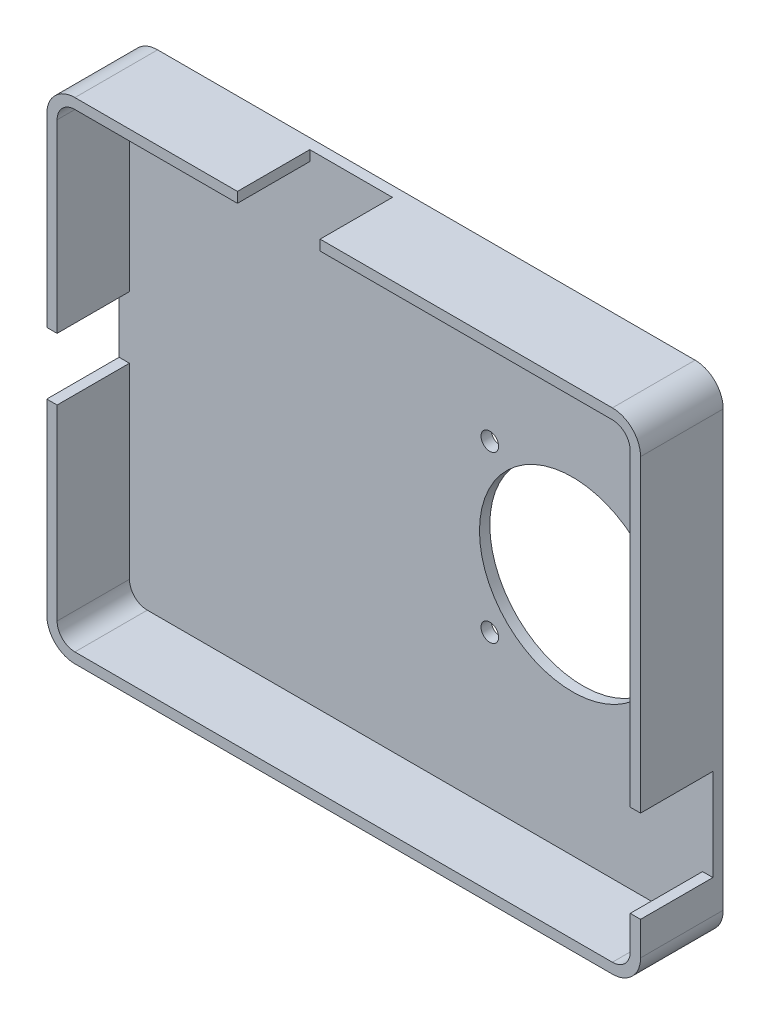
from build123d import *

# Parameters (mm, degrees)
BOSS_EXTRUDE1_DEPTH = 14
BOSS_EXTRUDE2_START = 2
BOSS_EXTRUDE2_DEPTH = 2
SKETCH4_W           = 2
SKETCH4_H           = 12
CUT_EXTRUDE1_DEPTH  = 94
SKETCH5_R           = 1.7
SKETCH5_R_2         = 18
CUT_EXTRUDE2_DEPTH  = 10
CUT_EXTRUDE3_DEPTH  = 1


with BuildPart() as part:
    # Sketch1 → Boss-Extrude1 (new body)
    with BuildSketch(Plane.XY):
        with BuildLine():
            Line((52, 47.45), (-52, 47.45))
            ThreePointArc((-52, 47.45), (-55.853731957, 45.853731957), (-57.45, 42))
            Line((-57.45, 42), (-57.45, -42))
            ThreePointArc((-57.45, -42), (-55.853731957, -45.853731957), (-52, -47.45))
            Line((-52, -47.45), (52, -47.45))
            ThreePointArc((52, -47.45), (55.853731957, -45.853731957), (57.45, -42))
            Line((57.45, -42), (57.45, 42))
            ThreePointArc((57.45, 42), (55.853731957, 45.853731957), (52, 47.45))
        make_face()
        with BuildLine():
            Line((52, 45.45), (-52, 45.45))
            ThreePointArc((-52, 45.45), (-54.439518395, 44.439518395), (-55.45, 42))
            Line((-55.45, 42), (-55.45, -42))
            ThreePointArc((-55.45, -42), (-54.439518395, -44.439518395), (-52, -45.45))
            Line((-52, -45.45), (52, -45.45))
            ThreePointArc((52, -45.45), (54.439518395, -44.439518395), (55.45, -42))
            Line((55.45, -42), (55.45, 42))
            ThreePointArc((55.45, 42), (54.439518395, 44.439518395), (52, 45.45))
        make_face(mode=Mode.SUBTRACT)
    extrude(amount=BOSS_EXTRUDE1_DEPTH)

    # Sketch2 → Boss-Extrude2 (add)
    with BuildSketch(Plane(origin=(0, 0, 0), x_dir=(-1, 0, 0), z_dir=(0, 0, -1)).offset(BOSS_EXTRUDE2_START)):
        with BuildLine():
            Line((-57.45, 42), (-57.45, -42))
            ThreePointArc((-57.45, -42), (-55.853731957, -45.853731957), (-52, -47.45))
            Line((-52, -47.45), (52, -47.45))
            ThreePointArc((52, -47.45), (55.853731957, -45.853731957), (57.45, -42))
            Line((57.45, -42), (57.45, 42))
            ThreePointArc((57.45, 42), (55.853731957, 45.853731957), (52, 47.45))
            Line((52, 47.45), (-52, 47.45))
            ThreePointArc((-52, 47.45), (-55.853731957, 45.853731957), (-57.45, 42))
        make_face()
    extrude(amount=-BOSS_EXTRUDE2_DEPTH)

    # Sketch4 → Cut-Extrude1 (cut)
    with BuildSketch(Plane.XY):
        Polygon((-4.554445608, 45.9), (-4.554445608, 47.45), (-20.554445608, 47.45), (-20.554445608, 45.45), (-4.554445608, 45.45), align=None)
        with Locations((-56.45, 0.205355748)):
            Rectangle(SKETCH4_W, SKETCH4_H)
        Polygon((55.445554392, -35.534861573), (57.45, -35.534861573), (57.45, -17.740217321), (55.45, -17.740217321), align=None)
    extrude(amount=CUT_EXTRUDE1_DEPTH, mode=Mode.SUBTRACT)

    # Sketch5 → Cut-Extrude2 (cut)
    with BuildSketch(Plane(origin=(0, 0, -2), x_dir=(-1, 0, 0), z_dir=(0, 0, -1))):
        with Locations((-14.281468852, 16)):
            Circle(SKETCH5_R)
        with Locations((-46.281468852, 16)):
            Circle(SKETCH5_R)
        with Locations((-46.281468852, -16)):
            Circle(SKETCH5_R)
        with Locations((-14.281468852, -16)):
            Circle(SKETCH5_R)
        with Locations((-30.281468852, 0)):
            Circle(SKETCH5_R_2)
    extrude(amount=-CUT_EXTRUDE2_DEPTH, mode=Mode.SUBTRACT)

    # Sketch6 → Cut-Extrude3 (cut)
    with BuildSketch(Plane(origin=(0, 0, -2), x_dir=(-1, 0, 0), z_dir=(0, 0, -1))):
        Polygon((25.401519513, 0), (20.78271736, 0), (30.173596476, -16.265479758), (39.564475593, 0), (34.945673439, 0), (30.173596476, -8.265479758), align=None)
        Polygon((24.070013842, 3.906235473), (26.325279944, 0), (26.433549893, 0), (33.901298637, 12.934520242), (29.282496484, 12.934520242), align=None)
        Polygon((-2.587238376, 17.734520242), (7.65179166, 0), (12.270593814, 0), (4.340964855, 13.734520242), (11.92932797, 13.734520242), (9.619926893, 17.734520242), align=None)
        Polygon((12.270593814, 0), (7.65179166, 0), (17.042670777, -16.265479758), (23.146253411, -5.693764527), (20.836852334, -1.693764527), (17.042670777, -8.265479758), align=None)
        Polygon((10.543687324, 17.734520242), (20.78271736, 0), (25.401519513, 0), (17.471890554, 13.734520242), (29.744376699, 13.734520242), (42.875302398, 13.734520242), (34.945673439, 0), (39.564475593, 0), (49.803505629, 17.734520242), (36.672579929, 17.734520242), align=None)
    extrude(amount=-CUT_EXTRUDE3_DEPTH, mode=Mode.SUBTRACT)


solid = part.part
